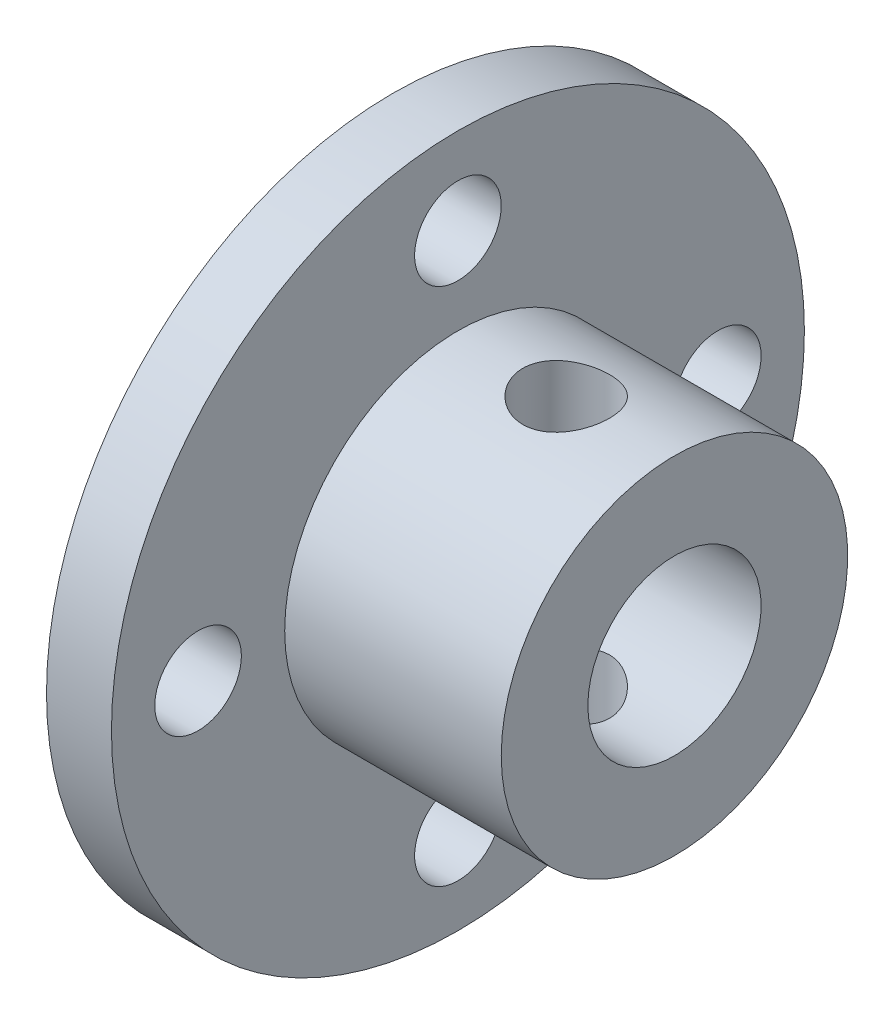
from build123d import *

# Parameters (mm, degrees)
SKETCH_2_R               = 2
CUT_EXTRUDE_1_DEPTH      = 10
CUT_EXTRUDE_2_DEPTH      = 10
CUT_EXTRUDE_2_DEPTH_BACK = 10
SKETCH_3_R               = 2


with BuildPart() as part:
    # 草图1 → 旋转1 (revolve)
    with BuildSketch(Plane(origin=(0, 0, 0), x_dir=(1, 0, 0), z_dir=(0, 1, 0))):
        Polygon((0, 16), (3, 16), (3, 8), (13, 8), (13, 4), (0, 4), align=None)
    revolve(axis=Axis((0, 0, 0), (1, 0, 0)))

    # 草图2 → 切除-拉伸1 (cut)
    with BuildSketch(Plane(origin=(3, 0, 0), x_dir=(0, 0, -1), z_dir=(1, 0, 0))):
        with Locations((12, 0)):
            Circle(SKETCH_2_R)
        with Locations((0, -12)):
            Circle(SKETCH_2_R)
        with Locations((-12, 0)):
            Circle(SKETCH_2_R)
        with Locations((0, 12)):
            Circle(SKETCH_2_R)
    extrude(amount=-CUT_EXTRUDE_1_DEPTH, mode=Mode.SUBTRACT)

    # 草图3 → 切除-拉伸2 (cut, two sides: drawn at the far end of the back side and taken through both)
    with BuildSketch(Plane(origin=(0, 0, 0), x_dir=(1, 0, 0), z_dir=(0, 1, 0)).offset(-CUT_EXTRUDE_2_DEPTH_BACK)):
        with Locations((8, 0)):
            Circle(SKETCH_3_R)
    extrude(amount=CUT_EXTRUDE_2_DEPTH + CUT_EXTRUDE_2_DEPTH_BACK, mode=Mode.SUBTRACT)


solid = part.part
